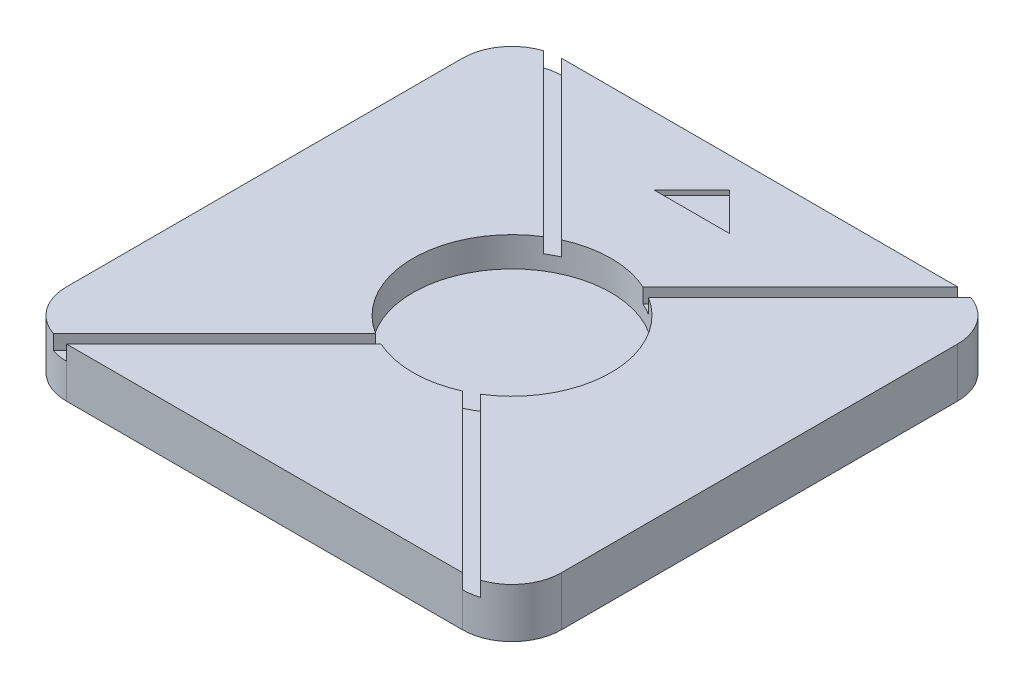
from build123d import *

# Parameters (mm, degrees)
EXTRUDE_1_DEPTH     = 10
CUT_EXTRUDE_START   = -3
CUT_EXTRUDE_1_DEPTH = 3
SKETCH_3_R          = 20
CUT_EXTRUDE_2_DEPTH = 6
CUT_EXTRUDE_3_DEPTH = 1


with BuildPart() as part:
    # 草图1 → 凸台-拉伸1 (new body)
    with BuildSketch(Plane(origin=(0, 0, 0), x_dir=(1, 0, 0), z_dir=(0, 1, 0))):
        with BuildLine():
            Line((-61.551724138, 50), (18.448275862, 50))
            ThreePointArc((18.448275862, 50), (25.519343674, 47.071067812), (28.448275862, 40))
            Line((28.448275862, 40), (28.448275862, -40))
            ThreePointArc((28.448275862, -40), (25.519343674, -47.071067812), (18.448275862, -50))
            Line((18.448275862, -50), (-61.551724138, -50))
            ThreePointArc((-61.551724138, -50), (-68.62279195, -47.071067812), (-71.551724138, -40))
            Line((-71.551724138, -40), (-71.551724138, 40))
            ThreePointArc((-71.551724138, 40), (-68.62279195, 47.071067812), (-61.551724138, 50))
        make_face()
    extrude(amount=EXTRUDE_1_DEPTH)

    # 草图2 → 切除-拉伸1 (cut)
    with BuildSketch(Plane(origin=(0, 10, 0), x_dir=(1, 0, 0), z_dir=(0, 1, 0)).offset(CUT_EXTRUDE_START)):
        with BuildLine():
            Line((-21.551724138, 10), (-61.551724138, 50))
            ThreePointArc((-61.551724138, 50), (-63.154135948, 49.870778915), (-64.715134679, 49.486455279))
            Line((-64.715134679, 49.486455279), (-21.551724138, 6.323044738))
            Line((-21.551724138, 6.323044738), (21.611686403, 49.486455279))
            ThreePointArc((21.611686403, 49.486455279), (20.050687672, 49.870778915), (18.448275862, 50))
            Line((18.448275862, 50), (-21.551724138, 10))
        make_face()
        with BuildLine():
            Line((-21.551724138, -10), (18.448275862, -50))
            ThreePointArc((18.448275862, -50), (20.050687672, -49.870778915), (21.611686403, -49.486455279))
            Line((21.611686403, -49.486455279), (-21.551724138, -6.323044738))
            Line((-21.551724138, -6.323044738), (-64.715134679, -49.486455279))
            ThreePointArc((-64.715134679, -49.486455279), (-63.154135948, -49.870778915), (-61.551724138, -50))
            Line((-61.551724138, -50), (-21.551724138, -10))
        make_face()
    extrude(amount=CUT_EXTRUDE_1_DEPTH, mode=Mode.SUBTRACT)

    # 草图3 → 切除-拉伸2 (cut)
    with BuildSketch(Plane(origin=(0, 10, 0), x_dir=(1, 0, 0), z_dir=(0, 1, 0))):
        with Locations(Location((-21.551724138, 0, 0), (0, 0, 270))):
            Circle(SKETCH_3_R)
    extrude(amount=-CUT_EXTRUDE_2_DEPTH, mode=Mode.SUBTRACT)

    # 草图5 → 切除-拉伸3 (cut)
    with BuildSketch(Plane(origin=(0, 10, 0), x_dir=(1, 0, 0), z_dir=(0, 1, 0))):
        Polygon((-21.551724138, 43.940949844), (-29.190091611, 36.302582371), (-13.913356665, 36.302582371), align=None)
    extrude(amount=-CUT_EXTRUDE_3_DEPTH, mode=Mode.SUBTRACT)


solid = part.part
